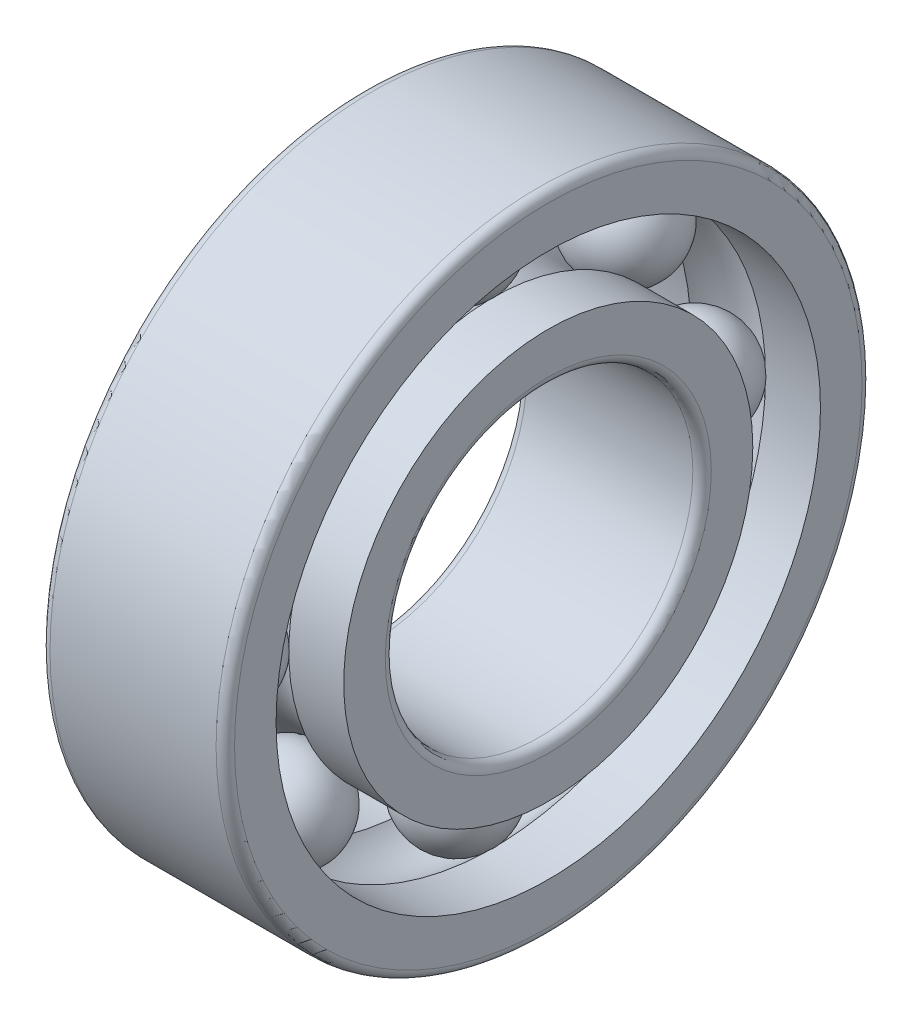
from build123d import *

# Parameters (mm, degrees)
R_P_TITION_CIRCULAIRE1_COUNT = 8
ESQUISSE1_W                  = 0.2
ESQUISSE1_H                  = 4.494773444


with BuildPart() as part:
    # BalDetSke → BallDetailed (revolve)
    with BuildSketch(Plane.XY):
        with BuildLine():
            Line((-3.3, 15.5), (3.3, 15.5))
            ThreePointArc((3.3, 15.5), (0, 12.2), (-3.3, 15.5))
        make_face()
    revolve(axis=Axis((-1.905, 15.5, 0), (1, 0, 0)))


with BuildPart() as body_2:
    # InnRacSke → InnerRace (revolve)
    with BuildSketch(Plane.XY):
        with BuildLine():
            Line((-2.426030709, 13.3), (-6, 13.3))
            Line((-6, 13.3), (-6, 10.6))
            ThreePointArc((-6, 10.6), (-5.824264069, 10.175735931), (-5.4, 10))
            Line((-5.4, 10), (5.4, 10))
            ThreePointArc((5.4, 10), (5.824264069, 10.175735931), (6, 10.6))
            Line((6, 10.6), (6, 13.3))
            Line((6, 13.3), (2.426030709, 13.3))
            ThreePointArc((2.426030709, 13.3), (0, 12.225), (-2.426030709, 13.3))
        make_face()
    revolve(axis=Axis((-20.6375, 0, 0), (1, 0, 0)))



with BuildPart() as body_3:
    # OutRacSke → OuterRace (revolve)
    with BuildSketch(Plane.XY):
        with BuildLine():
            Line((-2.426030709, 17.7), (-6, 17.7))
            Line((-6, 17.7), (-6, 20.4))
            ThreePointArc((-6, 20.4), (-5.824264069, 20.824264069), (-5.4, 21))
            Line((-5.4, 21), (5.4, 21))
            ThreePointArc((5.4, 21), (5.824264069, 20.824264069), (6, 20.4))
            Line((6, 20.4), (6, 17.7))
            Line((6, 17.7), (2.426030709, 17.7))
            ThreePointArc((2.426030709, 17.7), (0, 18.775), (-2.426030709, 17.7))
        make_face()
    revolve(axis=Axis((-20.6375, 0, 0), (1, 0, 0)))


with BuildPart() as r_p_tition_circulaire1_1:
    # Répétition circulaire1: pattern copy
    add(part.part.rotate(Axis((-20.6375, 0, 0), (1, 0, 0)), 1 * 360 / R_P_TITION_CIRCULAIRE1_COUNT))


with BuildPart() as r_p_tition_circulaire1_2:
    # Répétition circulaire1: pattern copy
    add(part.part.rotate(Axis((-20.6375, 0, 0), (1, 0, 0)), 2 * 360 / R_P_TITION_CIRCULAIRE1_COUNT))


with BuildPart() as r_p_tition_circulaire1_3:
    # Répétition circulaire1: pattern copy
    add(part.part.rotate(Axis((-20.6375, 0, 0), (1, 0, 0)), 3 * 360 / R_P_TITION_CIRCULAIRE1_COUNT))


with BuildPart() as r_p_tition_circulaire1_4:
    # Répétition circulaire1: pattern copy
    add(part.part.rotate(Axis((-20.6375, 0, 0), (1, 0, 0)), 4 * 360 / R_P_TITION_CIRCULAIRE1_COUNT))


with BuildPart() as r_p_tition_circulaire1_5:
    # Répétition circulaire1: pattern copy
    add(part.part.rotate(Axis((-20.6375, 0, 0), (1, 0, 0)), 5 * 360 / R_P_TITION_CIRCULAIRE1_COUNT))


with BuildPart() as r_p_tition_circulaire1_6:
    # Répétition circulaire1: pattern copy
    add(part.part.rotate(Axis((-20.6375, 0, 0), (1, 0, 0)), 6 * 360 / R_P_TITION_CIRCULAIRE1_COUNT))


with BuildPart() as r_p_tition_circulaire1_7:
    # Répétition circulaire1: pattern copy
    add(part.part.rotate(Axis((-20.6375, 0, 0), (1, 0, 0)), 7 * 360 / R_P_TITION_CIRCULAIRE1_COUNT))


with BuildPart() as body_2_1:
    add(body_2.part)

    add(body_3.part)  # Révolution1 merges body 3
    # Esquisse1 → Révolution1 (revolve)
    with BuildSketch(Plane.XY):
        with Locations((-5.788030791, 15.532457288)):
            Rectangle(ESQUISSE1_W, ESQUISSE1_H)
    revolve(axis=Axis((-20.6375, 0, 0), (1, 0, 0)))


solid = Compound([part.part, r_p_tition_circulaire1_1.part, r_p_tition_circulaire1_2.part, r_p_tition_circulaire1_3.part, r_p_tition_circulaire1_4.part, r_p_tition_circulaire1_5.part, r_p_tition_circulaire1_6.part, r_p_tition_circulaire1_7.part, body_2_1.part])
